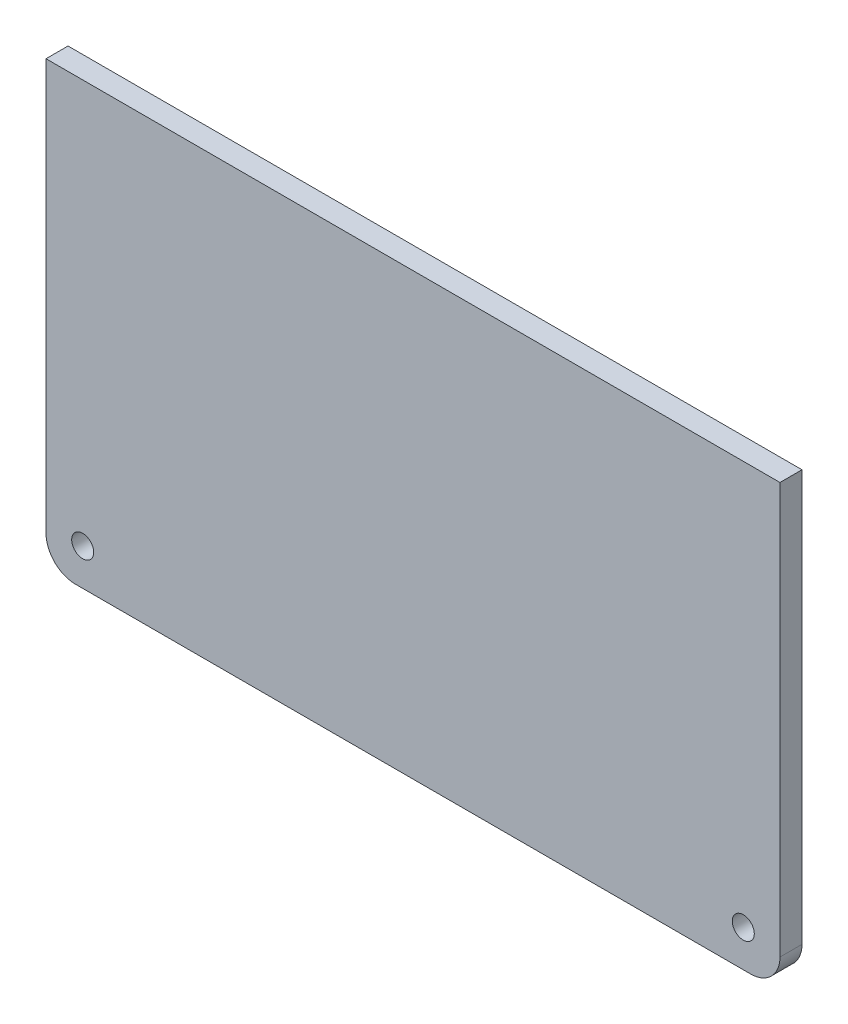
from build123d import *

# Parameters (mm, degrees)
SKETCH1_W           = 100
SKETCH1_H           = 60
BOSS_EXTRUDE1_DEPTH = 3
SKETCH2_R           = 1.5
CUT_EXTRUDE1_DEPTH  = 3
FILLET1_R           = 4


with BuildPart() as part:
    # Sketch1 → Boss-Extrude1 (new body)
    with BuildSketch(Plane.XY):
        with Locations((-7.495590829, 4.038800705)):
            Rectangle(SKETCH1_W, SKETCH1_H)
    extrude(amount=BOSS_EXTRUDE1_DEPTH)

    # Sketch2 → Cut-Extrude1 (cut)
    with BuildSketch(Plane.XY.offset(3)):
        with Locations((37.504409171, -20.961199295)):
            Circle(SKETCH2_R)
        with Locations((-52.500025419, -20.961199295)):
            Circle(SKETCH2_R)
    extrude(amount=-CUT_EXTRUDE1_DEPTH, mode=Mode.SUBTRACT)

    # Fillet1
    fillet1_edges = [part.edges().sort_by_distance(p)[0] for p in [
        (42.504409171, -25.961199295, 1.5),
        (-57.495590829, -25.961199295, 1.5),
    ]]
    fillet(fillet1_edges, radius=FILLET1_R)


solid = part.part
